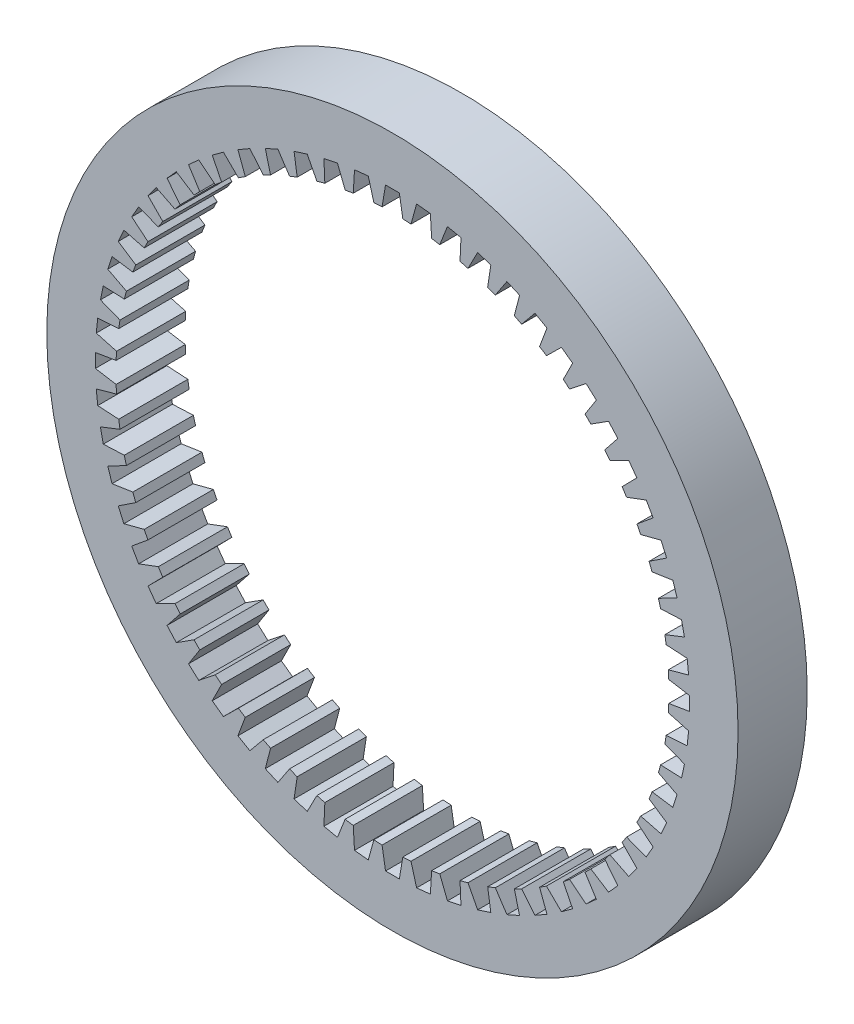
from build123d import *

# Parameters (mm, degrees)
SKETCH1_R           = 50
SKETCH1_R_2         = 40
BOSS_EXTRUDE1_DEPTH = 10
CUT_EXTRUDE1_DEPTH  = 10
CIRPATTERN1_COUNT   = 60


with BuildPart() as part:
    # Sketch1 → Boss-Extrude1 (new body)
    with BuildSketch(Plane.XY):
        Circle(SKETCH1_R)
        Circle(SKETCH1_R_2, mode=Mode.SUBTRACT)
    extrude(amount=BOSS_EXTRUDE1_DEPTH)

    # Sketch2 → Cut-Extrude1 (cut)
    with BuildSketch(Plane(origin=(0, 0, 0), x_dir=(-1, 0, 0), z_dir=(0, 0, -1))):
        with BuildLine():
            ThreePointArc((-1.5, 39.971865105), (-0.750131917, 39.992965658), (0, 40))
            Line((0, 40), (0, 42.971865105))
            Line((0, 42.971865105), (-1, 42.971865105))
            Line((-1, 42.971865105), (-1.5, 39.971865105))
        make_face()
        with BuildLine():
            Line((0, 42.971865105), (0, 40))
            ThreePointArc((0, 40), (0.750131917, 39.992965658), (1.5, 39.971865105))
            Line((1.5, 39.971865105), (1, 42.971865105))
            Line((1, 42.971865105), (0, 42.971865105))
        make_face()
    cut_extrude1 = extrude(amount=-CUT_EXTRUDE1_DEPTH, mode=Mode.SUBTRACT)

    # CirPattern1: Cut-Extrude1 ×60 about axis
    cirpattern1_axis = Axis((0, 0, 0), (0, 0, 1))
    for i in range(1, CIRPATTERN1_COUNT):
        add(cut_extrude1.rotate(cirpattern1_axis, i * 360 / CIRPATTERN1_COUNT), mode=Mode.SUBTRACT)


solid = part.part
